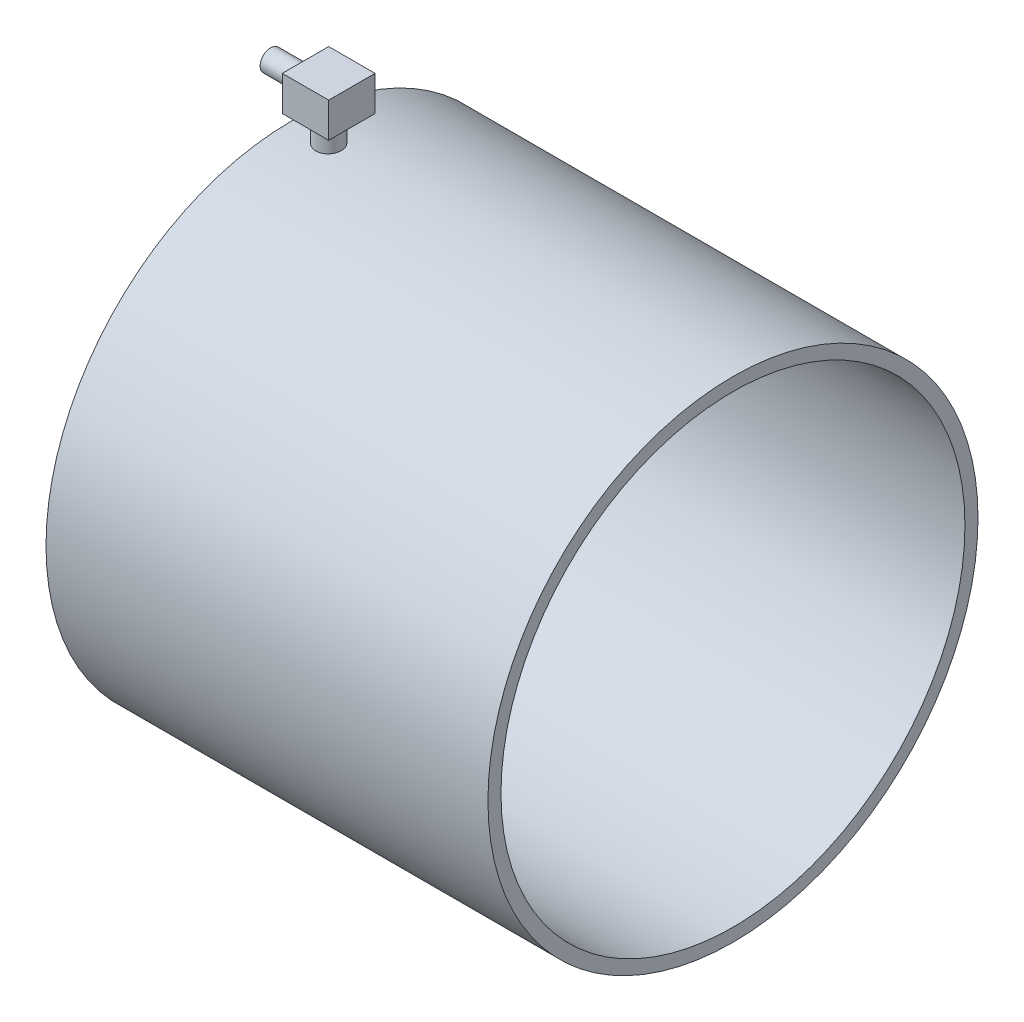
from build123d import *

# Parameters (mm, degrees)
SKETCH1_R           = 21.125
SKETCH1_R_2         = 20
BOSS_EXTRUDE1_DEPTH = 38.1
SKETCH2_R           = 1.104412627
BOSS_EXTRUDE2_DEPTH = 3
SKETCH3_W           = 4
SKETCH3_H           = 4
BOSS_EXTRUDE3_DEPTH = 3
SKETCH4_R           = 0.913347132
SKETCH4_R_2         = 0.661870058
BOSS_EXTRUDE4_DEPTH = 3


with BuildPart() as part:
    # Sketch1 → Boss-Extrude1 (new body)
    with BuildSketch(Plane(origin=(0, 0, 0), x_dir=(0, 0, -1), z_dir=(1, 0, 0))):
        Circle(SKETCH1_R)
        Circle(SKETCH1_R_2, mode=Mode.SUBTRACT)
    extrude(amount=BOSS_EXTRUDE1_DEPTH)


with BuildPart() as body_2:
    # Sketch2 → Boss-Extrude2 (new body)
    with BuildSketch(Plane(origin=(0, 20.330096143, 0), x_dir=(1, 0, 0), z_dir=(0, 1, 0))):
        with Locations(Location((3.244933056, 0, 0), (0, 0, 270))):
            Circle(SKETCH2_R)
    extrude(amount=BOSS_EXTRUDE2_DEPTH)

    # Sketch3 → Boss-Extrude3 (add)
    with BuildSketch(Plane(origin=(0, 23.330096143, 0), x_dir=(1, 0, 0), z_dir=(0, 1, 0))):
        with Locations((3.244933056, 0)):
            Rectangle(SKETCH3_W, SKETCH3_H)
    extrude(amount=BOSS_EXTRUDE3_DEPTH)

    # Sketch4 → Boss-Extrude4 (add)
    with BuildSketch(Plane.ZY.offset(-1.244933056)):
        with Locations(Location((0, 24.83009614, 0), (0, 0, 180))):
            Circle(SKETCH4_R)
        with Locations((0, 24.83009614)):
            Circle(SKETCH4_R_2, mode=Mode.SUBTRACT)
    extrude(amount=BOSS_EXTRUDE4_DEPTH)


solid = Compound([part.part, body_2.part])
